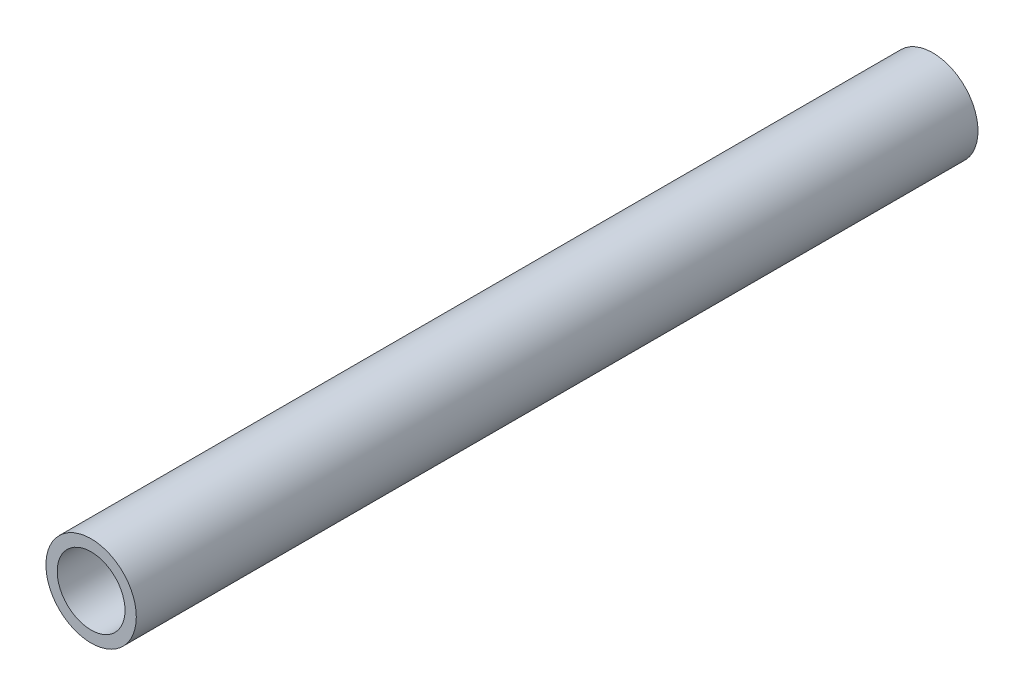
from build123d import *

# Parameters (mm, degrees)
SKETCH2_R           = 8
SKETCH2_R_2         = 6
BOSS_EXTRUDE1_DEPTH = 74.5


with BuildPart() as part:
    # Sketch2 → Boss-Extrude1 (new, symmetric)
    with BuildSketch(Plane.XY):
        Circle(SKETCH2_R)
        Circle(SKETCH2_R_2, mode=Mode.SUBTRACT)
    extrude(amount=BOSS_EXTRUDE1_DEPTH, both=True)


solid = part.part
